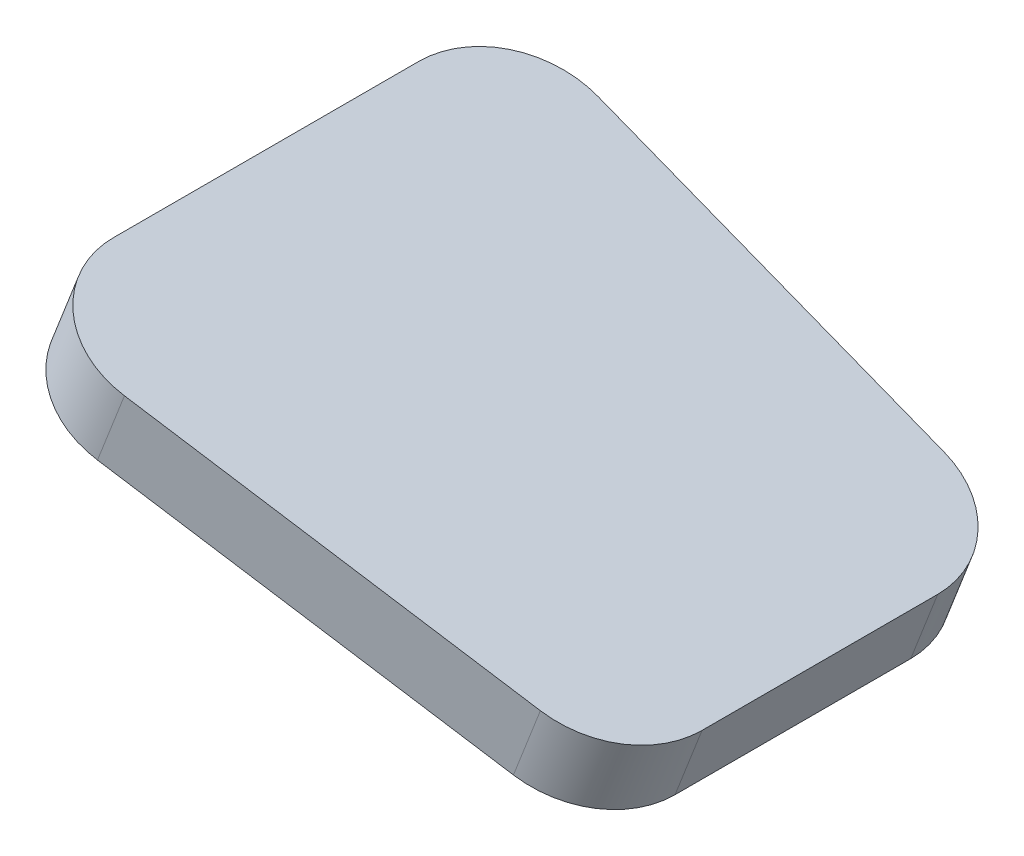
from build123d import *

# Parameters (mm, degrees)
BOSS_EXTRUDE1_DEPTH = 2.54


with BuildPart() as part:
    # Sketch1 → Boss-Extrude1 (new body)
    with BuildSketch(Plane(origin=(-4.89903509, -12.573036438, 0), x_dir=(0.9317661243126444, -0.3630590717547129, 0), z_dir=(0.36305907175471297, 0.9317661243126445, 0))):
        with BuildLine():
            Line((-64.284864007, -52.462183887), (-51.584864007, -50.06686577))
            ThreePointArc((-51.584864007, -50.06686577), (-49.729042729, -48.973235892), (-48.998318488, -46.946874372))
            Line((-48.998318488, -46.946874372), (-48.998318488, -38.884500478))
            ThreePointArc((-48.998318488, -38.884500478), (-49.928254458, -36.639436448), (-52.173318488, -35.709500478))
            Line((-52.173318488, -35.709500478), (-64.873318488, -35.709500478))
            ThreePointArc((-64.873318488, -35.709500478), (-67.118382519, -36.639436448), (-68.048318488, -38.884500478))
            Line((-68.048318488, -38.884500478), (-68.048318488, -49.342192489))
            ThreePointArc((-68.048318488, -49.342192489), (-66.899680008, -51.786468249), (-64.284864007, -52.462183887))
        make_face()
    extrude(amount=BOSS_EXTRUDE1_DEPTH)


solid = part.part
